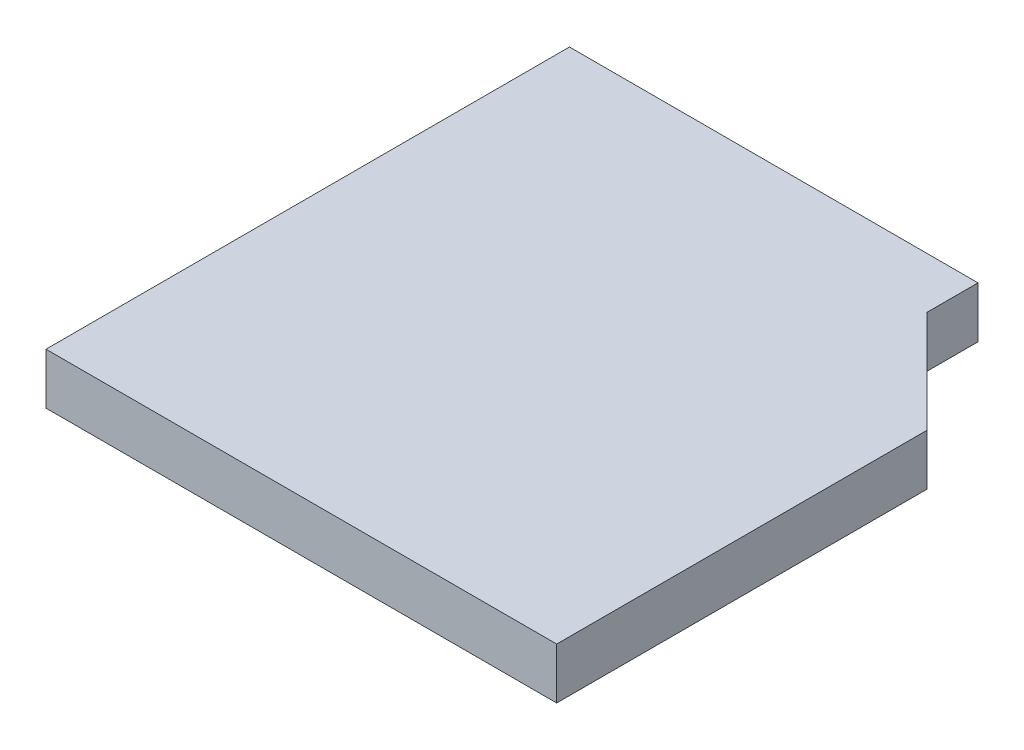
from build123d import *

# Parameters (mm, degrees)
BOSS_EXTRUDE1_DEPTH = 12.7


with BuildPart() as part:
    # Sketch1 → Boss-Extrude1 (new body)
    with BuildSketch(Plane(origin=(0, 0, 0), x_dir=(1, 0, 0), z_dir=(0, 1, 0))):
        Polygon((0, 0), (127, 0), (127, 92.075), (101.6, 117.475), (101.6, 130.175), (0, 130.175), align=None)
    extrude(amount=BOSS_EXTRUDE1_DEPTH)


solid = part.part
